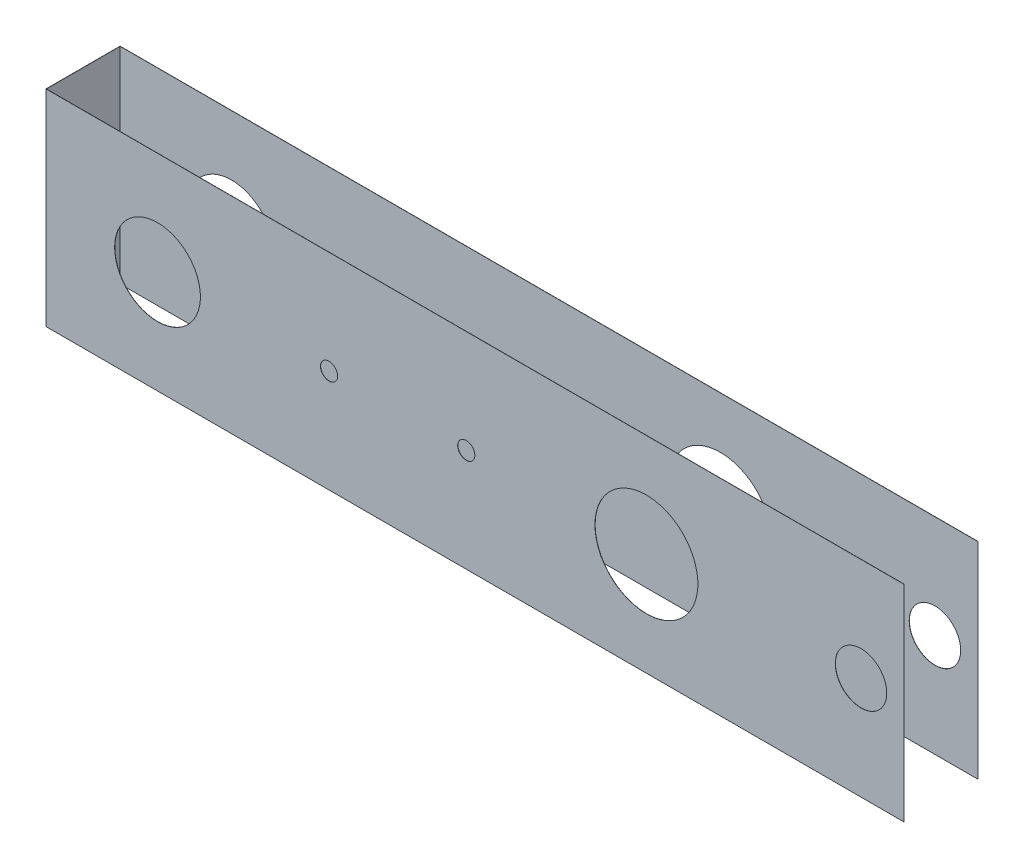
from build123d import *

# Parameters (mm, degrees)
EXTRUDE_1_DEPTH     = 120
SKETCH_2_R          = 25
SKETCH_2_R_2        = 5
SKETCH_2_R_3        = 30
SKETCH_2_R_4        = 15
CUT_EXTRUDE_1_DEPTH = 120


with BuildPart() as part:
    # 草图1 → 凸台-拉伸1 (new body)
    with BuildSketch(Plane(origin=(0, 0, 0), x_dir=(1, 0, 0), z_dir=(0, 1, 0))):
        Polygon((815.722184809, 138.335459402), (315.622184809, 138.335459402), (315.622184809, 95.135459402), (815.722184809, 95.135459402), (815.722184809, 95.235459402), (315.722184809, 95.235459402), (315.722184809, 138.235459402), (815.722184809, 138.235459402), align=None)
    extrude(amount=EXTRUDE_1_DEPTH)

    # 草图2 → 切除-拉伸1 (cut)
    with BuildSketch(Plane(origin=(0, 0, -138.335459402), x_dir=(-1, 0, 0), z_dir=(0, 0, -1))):
        with Locations((-380.622184809, 60)):
            Circle(SKETCH_2_R)
        with Locations((-480.622184809, 60)):
            Circle(SKETCH_2_R_2)
        with Locations((-560.622184809, 60)):
            Circle(SKETCH_2_R_2)
        with Locations((-665.622184809, 60)):
            Circle(SKETCH_2_R_3)
        with Locations((-790.722184809, 60)):
            Circle(SKETCH_2_R_4)
    extrude(amount=-CUT_EXTRUDE_1_DEPTH, mode=Mode.SUBTRACT)


solid = part.part
